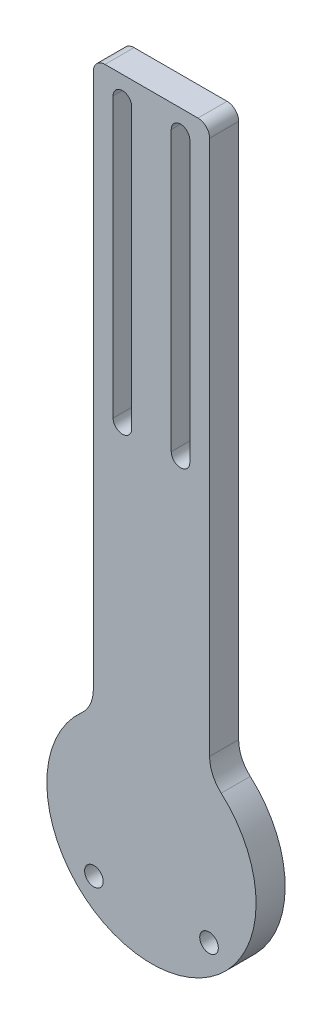
from build123d import *

# Parameters (mm, degrees)
SKETCH_1_R      = 1.6
EXTRUDE_1_DEPTH = 5


with BuildPart() as part:
    # 草图1 → 凸台-拉伸1 (new body)
    with BuildSketch(Plane.XY):
        with BuildLine():
            Line((-10, 110), (-10, 17.88854382))
            ThreePointArc((-10, 17.88854382), (-10.522774425, 15.439054077), (-12, 13.416407865))
            ThreePointArc((-12, 13.416407865), (0, -18), (12, 13.416407865))
            ThreePointArc((12, 13.416407865), (10.522774425, 15.439054077), (10, 17.88854382))
            Line((10, 17.88854382), (10, 110))
            ThreePointArc((10, 110), (9.414213562, 111.414213562), (8, 112))
            Line((8, 112), (-8, 112))
            ThreePointArc((-8, 112), (-9.414213562, 111.414213562), (-10, 110))
        make_face()
        with Locations((-9.899494937, -9.899494937)):
            Circle(SKETCH_1_R, mode=Mode.SUBTRACT)
        with Locations(Location((9.899494937, -9.899494937, 0), (0, 0, 180))):
            Circle(SKETCH_1_R, mode=Mode.SUBTRACT)
        with BuildLine():
            Line((-3.4, 108), (-3.4, 60))
            ThreePointArc((-3.4, 60), (-5, 58.4), (-6.6, 60))
            Line((-6.6, 60), (-6.6, 108))
            ThreePointArc((-6.6, 108), (-5, 109.6), (-3.4, 108))
        make_face(mode=Mode.SUBTRACT)
        with BuildLine():
            Line((3.4, 108), (3.4, 60))
            ThreePointArc((3.4, 60), (5, 58.4), (6.6, 60))
            Line((6.6, 60), (6.6, 108))
            ThreePointArc((6.6, 108), (5, 109.6), (3.4, 108))
        make_face(mode=Mode.SUBTRACT)
    extrude(amount=EXTRUDE_1_DEPTH)


solid = part.part
